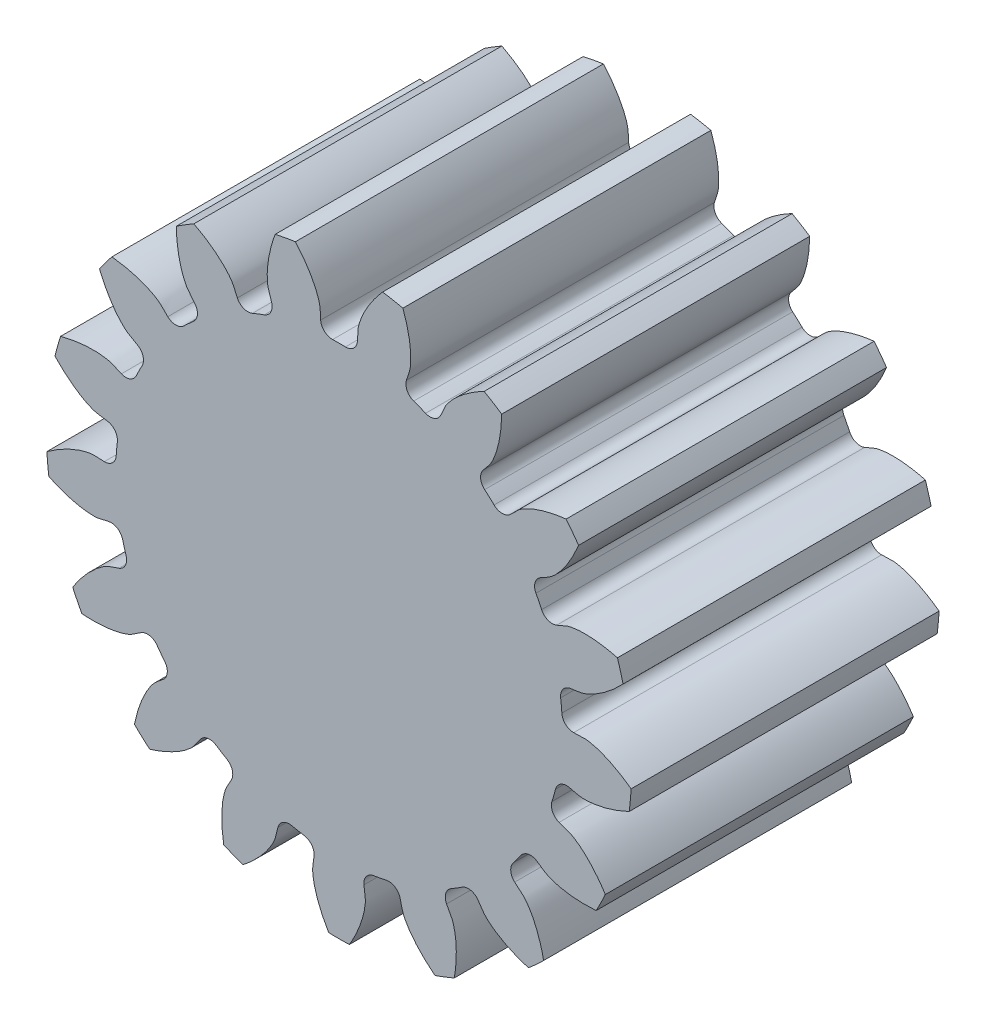
from build123d import *

# Parameters (mm, degrees)
SKETCH_1_R          = 9.5
LASHENA_DEPTH       = 10
CUT_EXTRUDEA_DEPTH  = 30
WWW_KYTOOL_CN_COUNT = 17


with BuildPart() as part:
    # 草图1 → LaShenA (new body)
    with BuildSketch(Plane.XY):
        Circle(SKETCH_1_R)
    extrude(amount=LASHENA_DEPTH)

    # SketchA → Cut-ExtrudeA (cut)
    with BuildSketch(Plane.XY.offset(10)):
        with BuildLine():
            ThreePointArc((0.207024597, 7.247043591), (0, 7.25), (-0.207024597, 7.247043591))
            ThreePointArc((-0.207024597, 7.247043591), (-0.472242082, 7.34458089), (-0.596793745, 7.59823562))
            add(Edge.make_bspline(
                [(-0.596793745, 7.59823562), (-0.606044253, 7.720567809), (-0.602564219, 7.869795024), (-0.629607947, 8.02899806), (-0.642220103, 8.080828168), (-0.653298413, 8.121829162), (-0.66746571, 8.16874208), (-0.685015757, 8.221435372), (-0.706306024, 8.279743397), (-0.731664706, 8.343492078), (-0.761420108, 8.412490908), (-0.795890592, 8.486535833), (-0.835386998, 8.565408724), (-0.880211198, 8.648877936), (-0.930655859, 8.736698559), (-0.987003843, 8.828612781), (-1.049527739, 8.924350251), (-1.118489374, 9.023628457), (-1.194139339, 9.126153124), (-1.276716542, 9.23161863), (-1.36644775, 9.339708439), (-1.463547201, 9.450095543), (-1.568216064, 9.562442937), (-1.721177274, 9.717492078), (-1.84330532, 9.830913041), (-1.928368213, 9.905667778)],
                knots=[0.121183801, 0.121183801, 0.121183801, 0.121183801, 0.238205786, 0.264316947, 0.275811996, 0.289397053, 0.305072119, 0.322837193, 0.342692276, 0.364637367, 0.388672467, 0.414797575, 0.443012693, 0.473317818, 0.505712953, 0.540198096, 0.576773247, 0.615438407, 0.656193576, 0.699038754, 0.74397394, 0.790999135, 0.840114338, 0.89131955, 1, 1, 1, 1], degree=3))
            ThreePointArc((-1.928368213, 9.905667778), (0, 10.091623165), (1.928368213, 9.905667778))
            add(Edge.make_bspline(
                [(0.596793745, 7.59823562), (0.606044253, 7.720567809), (0.602564219, 7.869795024), (0.629607947, 8.02899806), (0.642220103, 8.080828168), (0.653298413, 8.121829162), (0.66746571, 8.16874208), (0.685015757, 8.221435372), (0.706306024, 8.279743397), (0.731664706, 8.343492078), (0.761420108, 8.412490908), (0.795890592, 8.486535833), (0.835386998, 8.565408724), (0.880211198, 8.648877936), (0.930655859, 8.736698559), (0.987003843, 8.828612781), (1.049527739, 8.924350251), (1.118489374, 9.023628457), (1.194139339, 9.126153124), (1.276716542, 9.23161863), (1.36644775, 9.339708439), (1.463547201, 9.450095543), (1.568216064, 9.562442937), (1.721177274, 9.717492078), (1.84330532, 9.830913041), (1.928368213, 9.905667778)],
                knots=[0.121183801, 0.121183801, 0.121183801, 0.121183801, 0.238205786, 0.264316947, 0.275811996, 0.289397053, 0.305072119, 0.322837193, 0.342692276, 0.364637367, 0.388672467, 0.414797575, 0.443012693, 0.473317818, 0.505712953, 0.540198096, 0.576773247, 0.615438407, 0.656193576, 0.699038754, 0.74397394, 0.790999135, 0.840114338, 0.89131955, 1, 1, 1, 1], degree=3))
            ThreePointArc((0.596793745, 7.59823562), (0.472242082, 7.34458089), (0.207024597, 7.247043591))
        make_face()
    cut_extrudea = extrude(amount=-CUT_EXTRUDEA_DEPTH, mode=Mode.SUBTRACT)

    # www.KYTool.cn: Cut-ExtrudeA ×17 about axis
    www_kytool_cn_axis = Axis((0, 0, -88.99), (0, 0, 1))
    for i in range(1, WWW_KYTOOL_CN_COUNT):
        add(cut_extrudea.rotate(www_kytool_cn_axis, i * 360 / WWW_KYTOOL_CN_COUNT), mode=Mode.SUBTRACT)


solid = part.part
